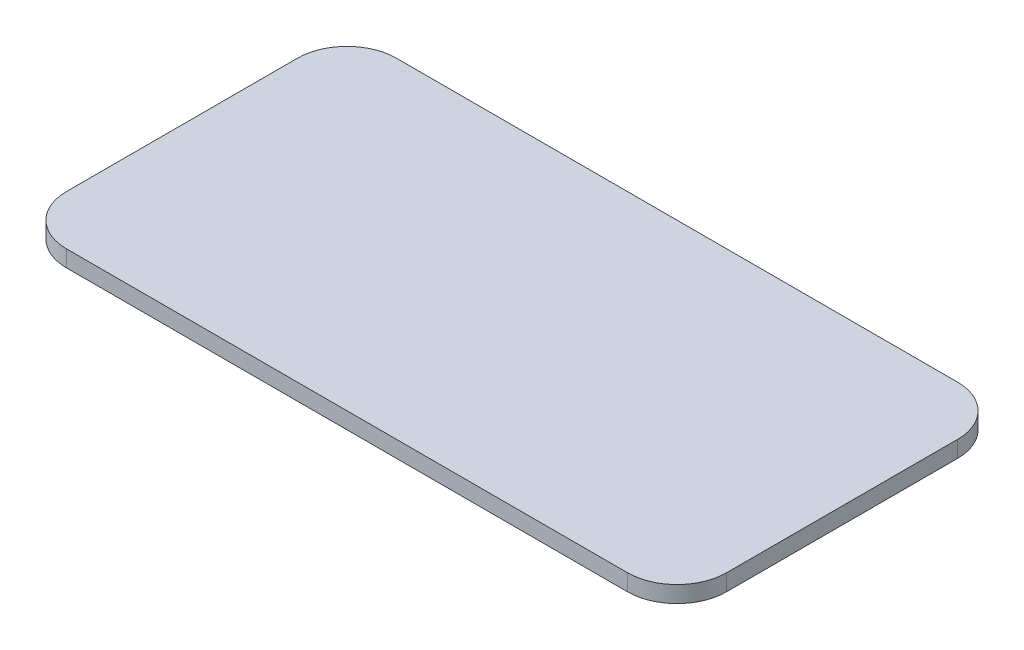
from build123d import *

# Parameters (mm, degrees)
SKETCH1_W           = 190.03
SKETCH1_H           = 90.03
SKETCH1_W_2         = 184.03
SKETCH1_H_2         = 84.03
BOSS_EXTRUDE1_DEPTH = 4
SKETCH2_W           = 200
SKETCH2_H           = 100
BOSS_EXTRUDE2_DEPTH = 5
FILLET1_R           = 15


with BuildPart() as part:
    # Sketch1 → Boss-Extrude1 (new body)
    with BuildSketch(Plane(origin=(0, 0, 0), x_dir=(1, 0, 0), z_dir=(0, 1, 0))):
        Rectangle(SKETCH1_W, SKETCH1_H)
        Rectangle(SKETCH1_W_2, SKETCH1_H_2, mode=Mode.SUBTRACT)
    extrude(amount=BOSS_EXTRUDE1_DEPTH)

    # Sketch2 → Boss-Extrude2 (add)
    with BuildSketch(Plane(origin=(0, 4, 0), x_dir=(1, 0, 0), z_dir=(0, 1, 0))):
        Rectangle(SKETCH2_W, SKETCH2_H)
    extrude(amount=BOSS_EXTRUDE2_DEPTH)

    # Fillet1
    fillet1_edges = [part.edges().sort_by_distance(p)[0] for p in [
        (92.015, 2, 42.015),
        (92.015, 2, -42.015),
        (-92.015, 2, -42.015),
        (-92.015, 2, 42.015),
        (100, 6.5, 50),
        (100, 6.5, -50),
        (-100, 6.5, -50),
        (-100, 6.5, 50),
        (95.015, 2, 45.015),
        (-95.015, 2, 45.015),
        (-95.015, 2, -45.015),
        (95.015, 2, -45.015),
    ]]
    fillet(fillet1_edges, radius=FILLET1_R)


solid = part.part
